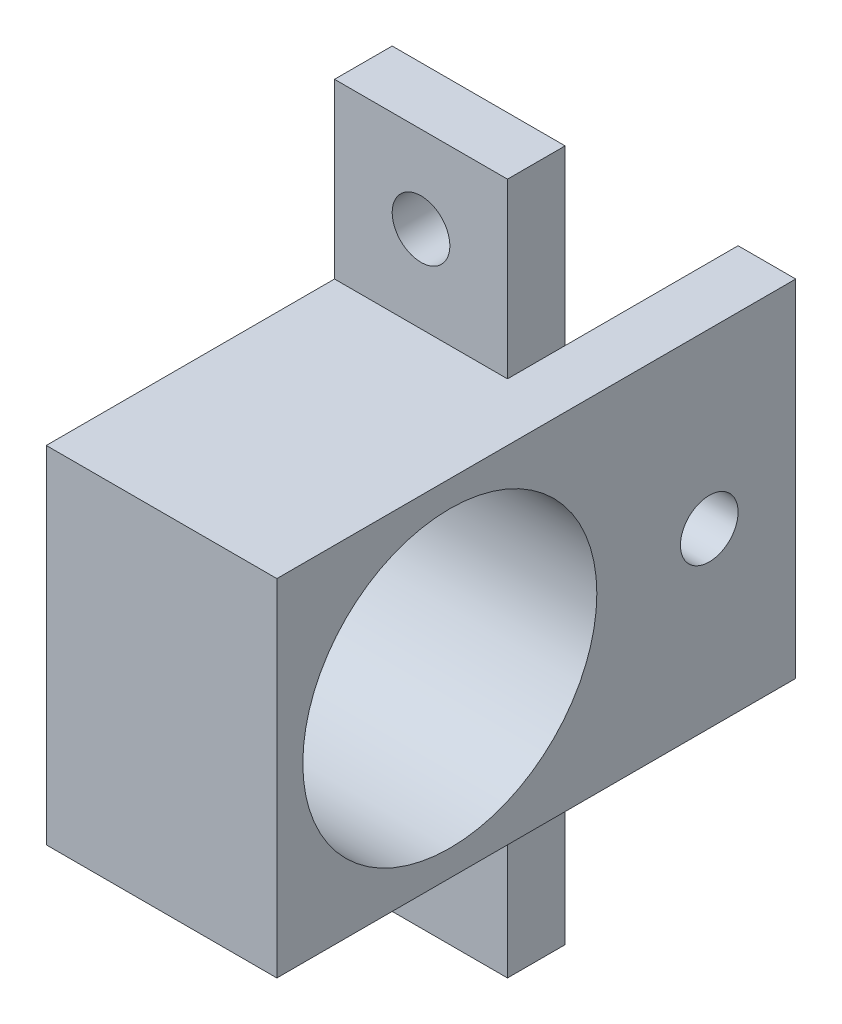
from build123d import *

# Parameters (mm, degrees)
SKETCH1_W           = 30
SKETCH1_H           = 15
BOSS_EXTRUDE1_DEPTH = 30
SKETCH2_W           = 30
SKETCH2_H           = 45
BOSS_EXTRUDE2_DEPTH = 5
SKETCH5_R           = 2.5
CUT_EXTRUDE2_DEPTH  = 47.904157598
SKETCH3_R           = 12.75
CUT_EXTRUDE3_DEPTH  = 47.904157598
SKETCH8_W           = 15
SKETCH8_H           = 15
SKETCH8_R           = 2.5
BOSS_EXTRUDE4_DEPTH = 5


with BuildPart() as part:
    # Sketch1 → Boss-Extrude1 (new body)
    with BuildSketch(Plane(origin=(0, 0, 0), x_dir=(0, 1, 0), z_dir=(0, 0, 1))):
        with Locations((15, 7.5)):
            Rectangle(SKETCH1_W, SKETCH1_H)
    extrude(amount=BOSS_EXTRUDE1_DEPTH)

    # Sketch2 → Boss-Extrude2 (add)
    with BuildSketch(Plane.YZ):
        with Locations((15, 7.5)):
            Rectangle(SKETCH2_W, SKETCH2_H)
    extrude(amount=BOSS_EXTRUDE2_DEPTH)

    # Sketch5 → Cut-Extrude2 (cut, through all)
    with BuildSketch(Plane.YZ.offset(5)):
        with Locations(Location((15, -7.5, 0), (0, 0, 270))):
            Circle(SKETCH5_R)
    extrude(amount=-CUT_EXTRUDE2_DEPTH, mode=Mode.SUBTRACT)

    # Sketch3 → Cut-Extrude3 (cut, through all)
    with BuildSketch(Plane.YZ.offset(5)):
        with Locations(Location((15, 15, 0), (0, 0, 270))):
            Circle(SKETCH3_R)
    extrude(amount=-CUT_EXTRUDE3_DEPTH, mode=Mode.SUBTRACT)

    # Sketch8 → Boss-Extrude4 (add)
    # profile 1 of 2: a face of its own
    with BuildSketch(Plane(origin=(0, 0, 0), x_dir=(1, 0, 0), z_dir=(0, 0, -1))):
        with Locations((-7.5, -37.5)):
            Rectangle(SKETCH8_W, SKETCH8_H)
        with Locations(Location((-7.5, -37.5, 0), (0, 0, 180))):
            Circle(SKETCH8_R, mode=Mode.SUBTRACT)
    # profile 2 of 2: a face of its own
    with BuildSketch(Plane(origin=(0, 0, 0), x_dir=(1, 0, 0), z_dir=(0, 0, -1))):
        with Locations((-7.5, 7.5)):
            Rectangle(SKETCH8_W, SKETCH8_H)
        with Locations(Location((-7.5, 7.5, 0), (0, 0, 180))):
            Circle(SKETCH8_R, mode=Mode.SUBTRACT)
    extrude(amount=-BOSS_EXTRUDE4_DEPTH)


solid = part.part
